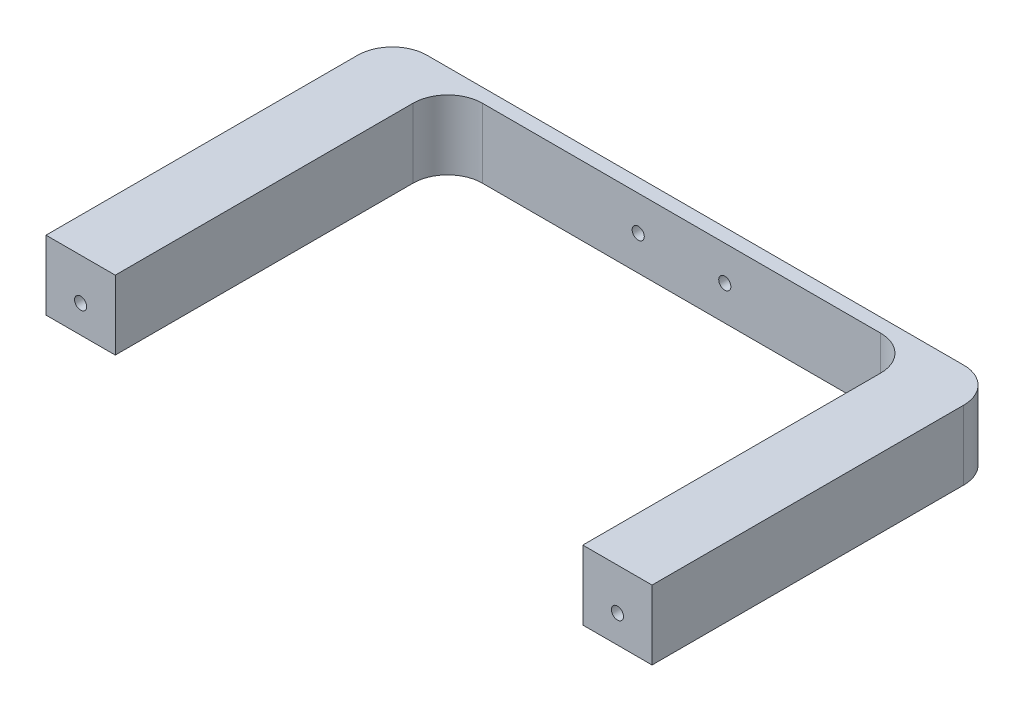
from build123d import *

# Parameters (mm, degrees)
BOSS_EXTRUDE1_DEPTH = 20
FILLET1_R           = 10
SKETCH2_R           = 1.75
CUT_EXTRUDE1_DEPTH  = 203.546291005
SKETCH3_W           = 12
SKETCH3_H           = 24
CUT_EXTRUDE2_DEPTH  = 16
SKETCH4_R           = 1.75
CUT_EXTRUDE3_DEPTH  = 201.601595208
SKETCH6_W           = 12
SKETCH6_H           = 16
BOSS_EXTRUDE2_DEPTH = 0.56


with BuildPart() as part:
    # Sketch1 → Boss-Extrude1 (new body)
    with BuildSketch(Plane(origin=(0, 0, 0), x_dir=(1, 0, 0), z_dir=(0, 1, 0))):
        Polygon((0, 0), (20, 0), (20, 96), (155, 96), (155, 0), (175, 0), (175, 100), (0, 100), align=None)
    extrude(amount=BOSS_EXTRUDE1_DEPTH)

    # Fillet1
    fillet1_edges = [part.edges().sort_by_distance(p)[0] for p in [
        (0, 10, -100),
        (175, 10, -100),
        (155, 10, -96),
        (20, 10, -96),
    ]]
    fillet(fillet1_edges, radius=FILLET1_R)

    # Sketch2 → Cut-Extrude1 (cut, through all)
    with BuildSketch(Plane(origin=(0, 0, -100), x_dir=(-1, 0, 0), z_dir=(0, 0, -1))):
        with Locations((-100, 10)):
            Circle(SKETCH2_R)
        with Locations((-75, 10)):
            Circle(SKETCH2_R)
    extrude(amount=-CUT_EXTRUDE1_DEPTH, mode=Mode.SUBTRACT)

    # Sketch3 → Cut-Extrude2 (cut)
    with BuildSketch(Plane.XZ):
        with Locations((10, -16)):
            Rectangle(SKETCH3_W, SKETCH3_H)
    cut_extrude2 = extrude(amount=-CUT_EXTRUDE2_DEPTH, mode=Mode.SUBTRACT)

    # Sketch4 → Cut-Extrude3 (cut, through all)
    with BuildSketch(Plane(origin=(0, 0, -4), x_dir=(-1, 0, 0), z_dir=(0, 0, -1))):
        with Locations((-10, 8)):
            Circle(SKETCH4_R)
    cut_extrude3 = extrude(amount=-CUT_EXTRUDE3_DEPTH, mode=Mode.SUBTRACT)

    # Mirror1: Cut-Extrude2, Cut-Extrude3 across plane
    add(cut_extrude2.mirror(Plane(origin=(87.5, 0, 0), x_dir=(0, 0, 1), z_dir=(1, 0, 0))), mode=Mode.SUBTRACT)
    add(cut_extrude3.mirror(Plane(origin=(87.5, 0, 0), x_dir=(0, 0, 1), z_dir=(1, 0, 0))), mode=Mode.SUBTRACT)

    # Sketch6 → Boss-Extrude2 (add)
    with BuildSketch(Plane(origin=(0, 0, -4), x_dir=(-1, 0, 0), z_dir=(0, 0, -1))):
        with Locations((-10, 8)):
            Rectangle(SKETCH6_W, SKETCH6_H)
    boss_extrude2 = extrude(amount=BOSS_EXTRUDE2_DEPTH)

    # Mirror2: Boss-Extrude2 across plane
    add(boss_extrude2.mirror(Plane(origin=(87.5, 0, 0), x_dir=(0, 0, 1), z_dir=(1, 0, 0))))


solid = part.part
